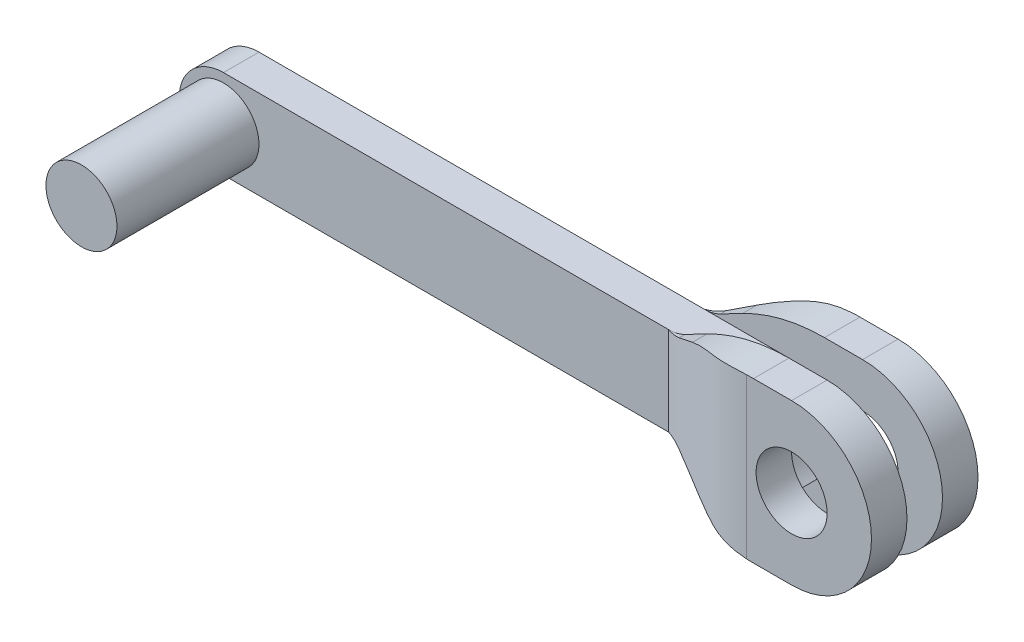
from build123d import *

# Parameters (mm, degrees)
BOSS_EXTRUDE1_DEPTH = 2
SKETCH2_R           = 2
BOSS_EXTRUDE2_DEPTH = 8
SKETCH5_R           = 3.5
CUT_EXTRUDE2_DEPTH  = 5
BOSS_EXTRUDE3_DEPTH = 2
CUT_EXTRUDE1_DEPTH  = 5.5
SKETCH6_R           = 2
CUT_EXTRUDE3_DEPTH  = 11


with BuildPart() as part:
    # Sketch1 → Boss-Extrude1 (new body)
    with BuildSketch(Plane.XY):
        with BuildLine():
            Line((0, -2.5), (34, -2.5))
            ThreePointArc((34, -2.5), (36.5, 0), (34, 2.5))
            Line((34, 2.5), (0, 2.5))
            ThreePointArc((0, 2.5), (-2.5, 0), (0, -2.5))
        make_face()
    extrude(amount=BOSS_EXTRUDE1_DEPTH)

    # Sketch2 → Boss-Extrude2 (add)
    with BuildSketch(Plane.XY.offset(2)):
        Circle(SKETCH2_R)
    extrude(amount=BOSS_EXTRUDE2_DEPTH)

    # Sketch5 → Cut-Extrude2 (cut, symmetric)
    with BuildSketch(Plane(origin=(0, 0, 0), x_dir=(-1, 0, 0), z_dir=(0, 0, -1))):
        with Locations((-34, 0)):
            Circle(SKETCH5_R)
    extrude(amount=CUT_EXTRUDE2_DEPTH, both=True, mode=Mode.SUBTRACT)

    # Sketch3 → Boss-Extrude3 (add)
    with BuildSketch(Plane(origin=(0, 0, 0), x_dir=(-1, 0, 0), z_dir=(0, 0, -1))):
        with BuildLine():
            Line((-34, -4.5), (-31.853983948, -4.5))
            ThreePointArc((-31.853983948, -4.5), (-29.476132044, -4.213177664), (-27.234684348, -3.369164065))
            Line((-27.234684348, -3.369164065), (-26.000115193, -2.726167187))
            ThreePointArc((-26.000115193, -2.726167187), (-25.551825654, -2.557364467), (-25.076255273, -2.5))
            Line((-25.076255273, -2.5), (-25.076255273, 2.5))
            ThreePointArc((-25.076255273, 2.5), (-25.551825654, 2.557364467), (-26.000115193, 2.726167187))
            Line((-26.000115193, 2.726167187), (-27.234684348, 3.369164065))
            ThreePointArc((-27.234684348, 3.369164065), (-29.476132044, 4.213177664), (-31.853983948, 4.5))
            Line((-31.853983948, 4.5), (-34, 4.5))
            ThreePointArc((-34, 4.5), (-38.5, 0), (-34, -4.5))
        make_face()
    boss_extrude3 = extrude(amount=BOSS_EXTRUDE3_DEPTH)

    # Sketch4 → Cut-Extrude1 (cut, symmetric)
    with BuildSketch(Plane(origin=(0, 0, 0), x_dir=(1, 0, 0), z_dir=(0, 1, 0))):
        with BuildLine():
            Line((31.853983948, 2), (31.853983948, 3.174344261))
            Line((31.853983948, 3.174344261), (24.383890118, 3.174344261))
            Line((24.383890118, 3.174344261), (25.076255273, 0))
            add(Edge.make_bspline(
                [(31.853983948, 2), (29.962456018, 2.02071595), (29.16990367, 1.605069608), (25.966821868, 0.283607958), (25.076255273, 0)],
                knots=[0, 0, 0, 0, 0.608348739, 1, 1, 1, 1], degree=3))
        make_face()
    cut_extrude1 = extrude(amount=CUT_EXTRUDE1_DEPTH, both=True, mode=Mode.SUBTRACT)

    # Mirror1: Boss-Extrude3, Cut-Extrude1 across plane
    add(boss_extrude3.mirror(Plane.XY.offset(1)))
    add(cut_extrude1.mirror(Plane.XY.offset(1)), mode=Mode.SUBTRACT)

    # Sketch6 → Cut-Extrude3 (cut, symmetric)
    with BuildSketch(Plane(origin=(0, 0, -2), x_dir=(-1, 0, 0), z_dir=(0, 0, -1))):
        with Locations(Location((-34, 0, 0), (0, 0, 180))):
            Circle(SKETCH6_R)
    extrude(amount=CUT_EXTRUDE3_DEPTH, both=True, mode=Mode.SUBTRACT)


solid = part.part
